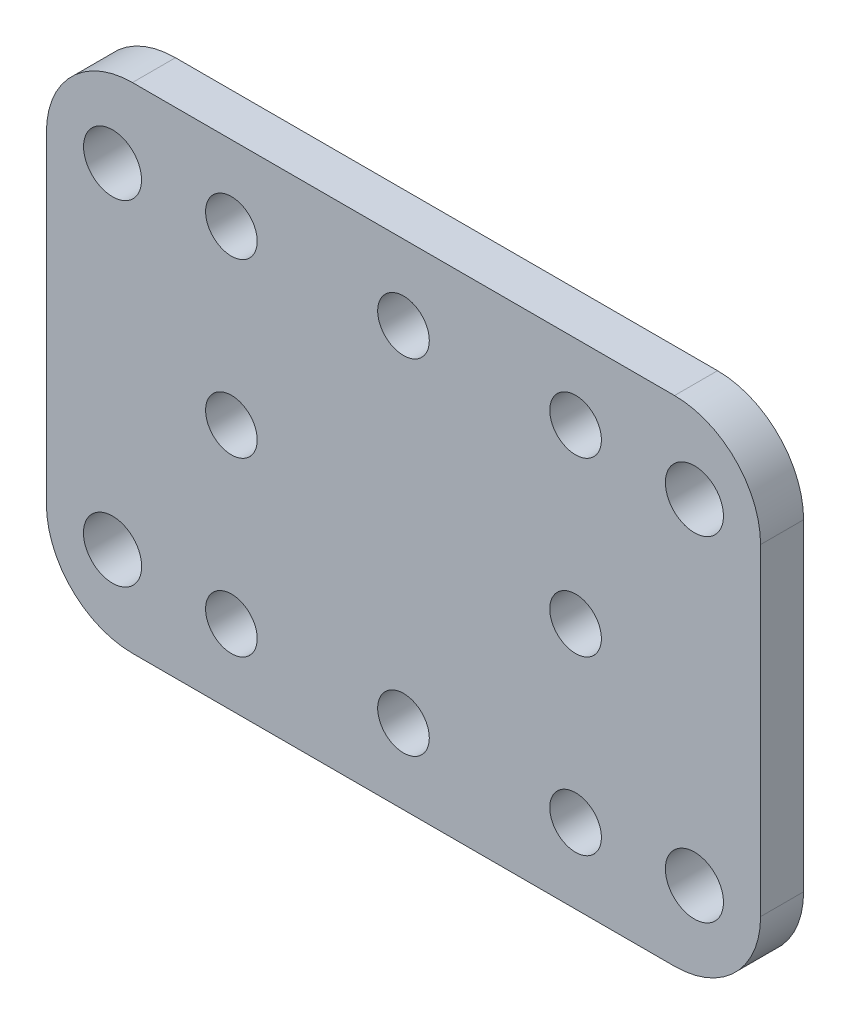
from build123d import *

# Parameters (mm, degrees)
CROQUIS1_W              = 33.201006025
CROQUIS1_H              = 22.978323476
SALIENTE_EXTRUIR1_DEPTH = 2
CROQUIS3_R              = 1.35
CROQUIS3_R_2            = 1.347868192
CROQUIS3_R_3            = 1.352554563
CORTAR_EXTRUIR2_DEPTH   = 41.51793761
REDONDEO2_R             = 4
REDONDEO3_R             = 4
CORTAR_EXTRUIR3_DEPTH   = 41.51793761


with BuildPart() as part:
    # Croquis1 → Saliente-Extruir1 (new body)
    with BuildSketch(Plane.XY):
        with Locations((16.58985656, 11.664742893)):
            Rectangle(CROQUIS1_W, CROQUIS1_H)
    extrude(amount=SALIENTE_EXTRUIR1_DEPTH)

    # Croquis3 → Cortar-Extruir2 (cut, through all)
    with BuildSketch(Plane(origin=(0, 0, 0), x_dir=(-1, 0, 0), z_dir=(0, 0, -1))):
        with Locations((-30.114791782, 19.441420757)):
            Circle(CROQUIS3_R)
        with Locations((-3.064921335, 19.441420756)):
            Circle(CROQUIS3_R_2)
        with Locations((-3.064921337, 3.888065031)):
            Circle(CROQUIS3_R_3)
        with Locations((-30.114791782, 3.888065031)):
            Circle(CROQUIS3_R)
    extrude(amount=-CORTAR_EXTRUIR2_DEPTH, mode=Mode.SUBTRACT)

    # Redondeo2
    redondeo2_edges = [part.edges().sort_by_distance(p)[0] for p in [
        (33.190359572, 23.153904631, 1),
        (33.190359572, 0.175581155, 1),
    ]]
    fillet(redondeo2_edges, radius=REDONDEO2_R)

    # Redondeo3
    redondeo3_edges = [part.edges().sort_by_distance(p)[0] for p in [
        (-0.010646453, 23.153904631, 1),
        (-0.010646453, 0.175581155, 1),
    ]]
    fillet(redondeo3_edges, radius=REDONDEO3_R)

    # Croquis4 → Cortar-Extruir3 (cut, through all)
    with BuildSketch(Plane.XY.offset(2)):
        with BuildLine():
            Line((8.589856559, 18.464742893), (8.589856559, 19.664742893))
            Line((8.589856559, 19.664742893), (9.789856559, 19.664742893))
            ThreePointArc((9.789856559, 19.664742893), (7.741328422, 20.513271031), (8.589856559, 18.464742893))
        make_face()
        with BuildLine():
            Line((9.789856559, 19.664742893), (8.589856559, 19.664742893))
            Line((8.589856559, 19.664742893), (8.589856559, 18.464742893))
            ThreePointArc((8.589856559, 18.464742893), (9.438384697, 18.816214756), (9.789856559, 19.664742893))
        make_face()
        with BuildLine():
            ThreePointArc((9.789856559, 11.664742893), (9.438384697, 12.513271031), (8.589856559, 12.864742893))
            Line((8.589856559, 12.864742893), (8.589856559, 10.464742893))
            ThreePointArc((8.589856559, 10.464742893), (9.438384697, 10.816214756), (9.789856559, 11.664742893))
        make_face()
        with BuildLine():
            Line((8.589856559, 10.464742893), (8.589856559, 12.864742893))
            ThreePointArc((8.589856559, 12.864742893), (7.389856559, 11.664742893), (8.589856559, 10.464742893))
        make_face()
        with BuildLine():
            ThreePointArc((9.789856559, 3.664742893), (9.438384697, 4.513271031), (8.589856559, 4.864742893))
            Line((8.589856559, 4.864742893), (8.589856559, 3.664742893))
            Line((8.589856559, 3.664742893), (9.789856559, 3.664742893))
        make_face()
        with BuildLine():
            Line((8.589856559, 3.664742893), (8.589856559, 4.864742893))
            ThreePointArc((8.589856559, 4.864742893), (7.741328422, 2.816214756), (9.789856559, 3.664742893))
            Line((9.789856559, 3.664742893), (8.589856559, 3.664742893))
        make_face()
        with BuildLine():
            ThreePointArc((17.789856559, 3.664742893), (16.589856559, 4.864742893), (15.389856559, 3.664742893))
            Line((15.389856559, 3.664742893), (17.789856559, 3.664742893))
        make_face()
        with BuildLine():
            Line((17.789856559, 3.664742893), (15.389856559, 3.664742893))
            ThreePointArc((15.389856559, 3.664742893), (16.589856559, 2.464742893), (17.789856559, 3.664742893))
        make_face()
        with BuildLine():
            ThreePointArc((25.789856559, 3.664742893), (25.438384697, 4.513271031), (24.589856559, 4.864742893))
            Line((24.589856559, 4.864742893), (24.589856559, 3.664742893))
            Line((24.589856559, 3.664742893), (23.389856559, 3.664742893))
            ThreePointArc((23.389856559, 3.664742893), (24.589856559, 2.464742893), (25.789856559, 3.664742893))
        make_face()
        with BuildLine():
            Line((24.589856559, 3.664742893), (24.589856559, 4.864742893))
            ThreePointArc((24.589856559, 4.864742893), (23.741328422, 4.513271031), (23.389856559, 3.664742893))
            Line((23.389856559, 3.664742893), (24.589856559, 3.664742893))
        make_face()
        with BuildLine():
            ThreePointArc((25.789856559, 11.664742893), (25.438384697, 12.513271031), (24.589856559, 12.864742893))
            Line((24.589856559, 12.864742893), (24.589856559, 10.464742893))
            ThreePointArc((24.589856559, 10.464742893), (25.438384697, 10.816214756), (25.789856559, 11.664742893))
        make_face()
        with BuildLine():
            Line((24.589856559, 10.464742893), (24.589856559, 12.864742893))
            ThreePointArc((24.589856559, 12.864742893), (23.389856559, 11.664742893), (24.589856559, 10.464742893))
        make_face()
        with BuildLine():
            ThreePointArc((25.789856559, 19.664742893), (24.589856559, 20.864742893), (23.389856559, 19.664742893))
            Line((23.389856559, 19.664742893), (24.589856559, 19.664742893))
            Line((24.589856559, 19.664742893), (24.589856559, 18.464742893))
            ThreePointArc((24.589856559, 18.464742893), (25.438384697, 18.816214756), (25.789856559, 19.664742893))
        make_face()
        with BuildLine():
            Line((24.589856559, 19.664742893), (23.389856559, 19.664742893))
            ThreePointArc((23.389856559, 19.664742893), (23.741328422, 18.816214756), (24.589856559, 18.464742893))
            Line((24.589856559, 18.464742893), (24.589856559, 19.664742893))
        make_face()
        with BuildLine():
            ThreePointArc((17.789856559, 19.664742893), (16.589856559, 20.864742893), (15.389856559, 19.664742893))
            Line((15.389856559, 19.664742893), (17.789856559, 19.664742893))
        make_face()
        with BuildLine():
            Line((17.789856559, 19.664742893), (15.389856559, 19.664742893))
            ThreePointArc((15.389856559, 19.664742893), (16.589856559, 18.464742893), (17.789856559, 19.664742893))
        make_face()
    extrude(amount=-CORTAR_EXTRUIR3_DEPTH, mode=Mode.SUBTRACT)


solid = part.part
